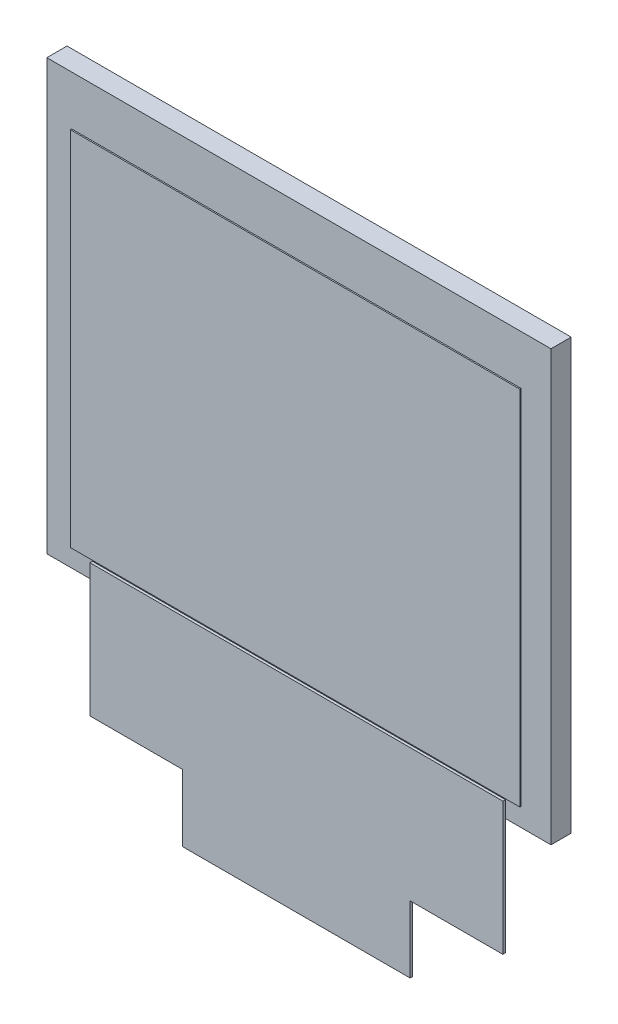
from build123d import *

# Parameters (mm, degrees)
SKETCH_1_W      = 39.9
SKETCH_1_H      = 34
EXTRUDE_1_DEPTH = 1.6
EXTRUDE_2_DEPTH = 0.2
SKETCH_3_W      = 35.575
SKETCH_3_H      = 28.64
EXTRUDE_3_DEPTH = 0.1


with BuildPart() as part:
    # 草图1 → 凸台-拉伸1 (new body)
    with BuildSketch(Plane.XY):
        Rectangle(SKETCH_1_W, SKETCH_1_H)
    extrude(amount=EXTRUDE_1_DEPTH)

    # 草图2 → 凸台-拉伸2 (add)
    with BuildSketch(Plane.XY.offset(1.6)):
        Polygon((-16.34, -15.707906265), (16.34, -15.707906265), (16.34, -26.207906265), (9, -26.207906265), (9, -31.5), (-9, -31.5), (-9, -26.207906265), (-16.34, -26.207906265), align=None)
    extrude(amount=EXTRUDE_2_DEPTH)


with BuildPart() as body_2:
    # 草图3 → 凸台-拉伸3 (new body)
    with BuildSketch(Plane.XY.offset(1.8)):
        with Locations((0, -1.02)):
            Rectangle(SKETCH_3_W, SKETCH_3_H)
    extrude(amount=EXTRUDE_3_DEPTH)


solid = Compound([part.part, body_2.part])
